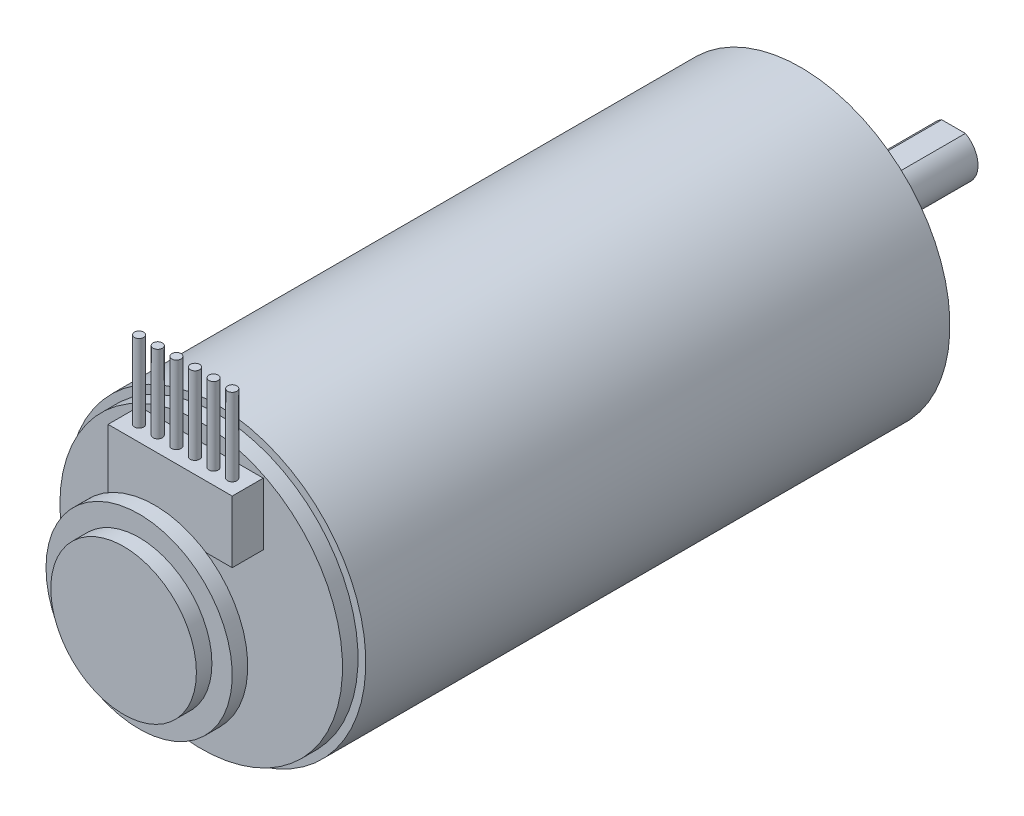
from build123d import *

# Parameters (mm, degrees)
SKETCH2_R            = 3.50000001
BOSS_EXTRUDE1_DEPTH  = 2.500000004
SKETCH3_R            = 1.999999988
BOSS_EXTRUDE2_DEPTH  = 9.99999999
CUT_EXTRUDE1_START   = -8.000000002
CUT_EXTRUDE1_DEPTH   = 8.000000002
SKETCH5_R            = 5.957710945
BOSS_EXTRUDE3_DEPTH  = 1.27
SKETCH6_W            = 10.160000002
SKETCH6_H            = 5.079999996
BOSS_EXTRUDE4_DEPTH  = 2.54
SKETCH7_R            = 0.381
BOSS_EXTRUDE5_DEPTH  = 6.35
SKETCH8_R            = 0.381
BOSS_EXTRUDE6_DEPTH  = 6.35
SKETCH9_R            = 0.381
BOSS_EXTRUDE7_DEPTH  = 6.35
SKETCH10_R           = 0.381
BOSS_EXTRUDE8_DEPTH  = 6.35
SKETCH11_R           = 0.381
BOSS_EXTRUDE9_DEPTH  = 6.35
SKETCH12_R           = 0.381
BOSS_EXTRUDE10_DEPTH = 6.35


with BuildPart() as part:
    # Sketch1 → Revolve1 (revolve)
    with BuildSketch(Plane.XZ, mode=Mode.PRIVATE) as revolve1_sk:
        Polygon((7.62, 66.649999999), (0, 66.649999999), (0, 12.499999994), (12.200000009, 12.499999994), (12.200000009, 60.299999999), (11.565000009, 60.299999999), (11.565000009, 61.569999999), (1.27, 61.569999999), (1.27, 65.379999999), (7.62, 65.379999999), align=None)
    revolve(revolve1_sk.sketch.rotate(Axis((0, 0, 66.649999999), (0, 0, -1)), 180), axis=Axis((0, 0, 66.649999999), (0, 0, -1)))

    # Sketch2 → Boss-Extrude1 (add)
    with BuildSketch(Plane(origin=(0, 0, 12.499999994), x_dir=(-1, 0, 0), z_dir=(0, 0, -1))):
        Circle(SKETCH2_R)
    extrude(amount=BOSS_EXTRUDE1_DEPTH)

    # Sketch3 → Boss-Extrude2 (add)
    with BuildSketch(Plane(origin=(0, 0, 9.99999999), x_dir=(-1, 0, 0), z_dir=(0, 0, -1))):
        Circle(SKETCH3_R)
    extrude(amount=BOSS_EXTRUDE2_DEPTH)

    # Sketch4 → Cut-Extrude1 (cut)
    with BuildSketch(Plane(origin=(0, 0, 0), x_dir=(-1, 0, 0), z_dir=(0, 0, -1)).offset(CUT_EXTRUDE1_START)):
        with BuildLine():
            Line((-0.968245816, 1.749999997), (0.968245816, 1.749999997))
            ThreePointArc((0.968245816, 1.749999997), (0, 1.999999988), (-0.968245816, 1.749999997))
        make_face()
    extrude(amount=CUT_EXTRUDE1_DEPTH, mode=Mode.SUBTRACT)

    # Sketch5 → Boss-Extrude3 (add)
    with BuildSketch(Plane.XY.offset(66.649999999)):
        Circle(SKETCH5_R)
    extrude(amount=BOSS_EXTRUDE3_DEPTH)

    # Sketch6 → Boss-Extrude4 (add)
    with BuildSketch(Plane.XY.offset(61.569999999)):
        with Locations((0, 7.619999999)):
            Rectangle(SKETCH6_W, SKETCH6_H)
    extrude(amount=BOSS_EXTRUDE4_DEPTH)

    # Sketch7 → Boss-Extrude5 (add)
    with BuildSketch(Plane(origin=(0, 10.159999997, 0), x_dir=(-1, 0, 0), z_dir=(0, 1, 0))):
        with Locations(Location((-2.286, 62.839999999, 0), (0, 0, 270))):
            Circle(SKETCH7_R)
    extrude(amount=BOSS_EXTRUDE5_DEPTH)

    # Sketch8 → Boss-Extrude6 (add)
    with BuildSketch(Plane(origin=(0, 10.159999997, 0), x_dir=(-1, 0, 0), z_dir=(0, 1, 0))):
        with Locations(Location((3.81, 62.839999999, 0), (0, 0, 270))):
            Circle(SKETCH8_R)
    extrude(amount=BOSS_EXTRUDE6_DEPTH)

    # Sketch9 → Boss-Extrude7 (add)
    with BuildSketch(Plane(origin=(0, 10.159999997, 0), x_dir=(-1, 0, 0), z_dir=(0, 1, 0))):
        with Locations(Location((0.762, 62.839999999, 0), (0, 0, 270))):
            Circle(SKETCH9_R)
    extrude(amount=BOSS_EXTRUDE7_DEPTH)

    # Sketch10 → Boss-Extrude8 (add)
    with BuildSketch(Plane(origin=(0, 10.159999997, 0), x_dir=(-1, 0, 0), z_dir=(0, 1, 0))):
        with Locations(Location((2.286, 62.839999999, 0), (0, 0, 270))):
            Circle(SKETCH10_R)
    extrude(amount=BOSS_EXTRUDE8_DEPTH)

    # Sketch11 → Boss-Extrude9 (add)
    with BuildSketch(Plane(origin=(0, 10.159999997, 0), x_dir=(-1, 0, 0), z_dir=(0, 1, 0))):
        with Locations(Location((-0.762, 62.839999999, 0), (0, 0, 270))):
            Circle(SKETCH11_R)
    extrude(amount=BOSS_EXTRUDE9_DEPTH)

    # Sketch12 → Boss-Extrude10 (add)
    with BuildSketch(Plane(origin=(0, 10.159999997, 0), x_dir=(-1, 0, 0), z_dir=(0, 1, 0))):
        with Locations(Location((-3.81, 62.839999999, 0), (0, 0, 270))):
            Circle(SKETCH12_R)
    extrude(amount=BOSS_EXTRUDE10_DEPTH)


solid = part.part
